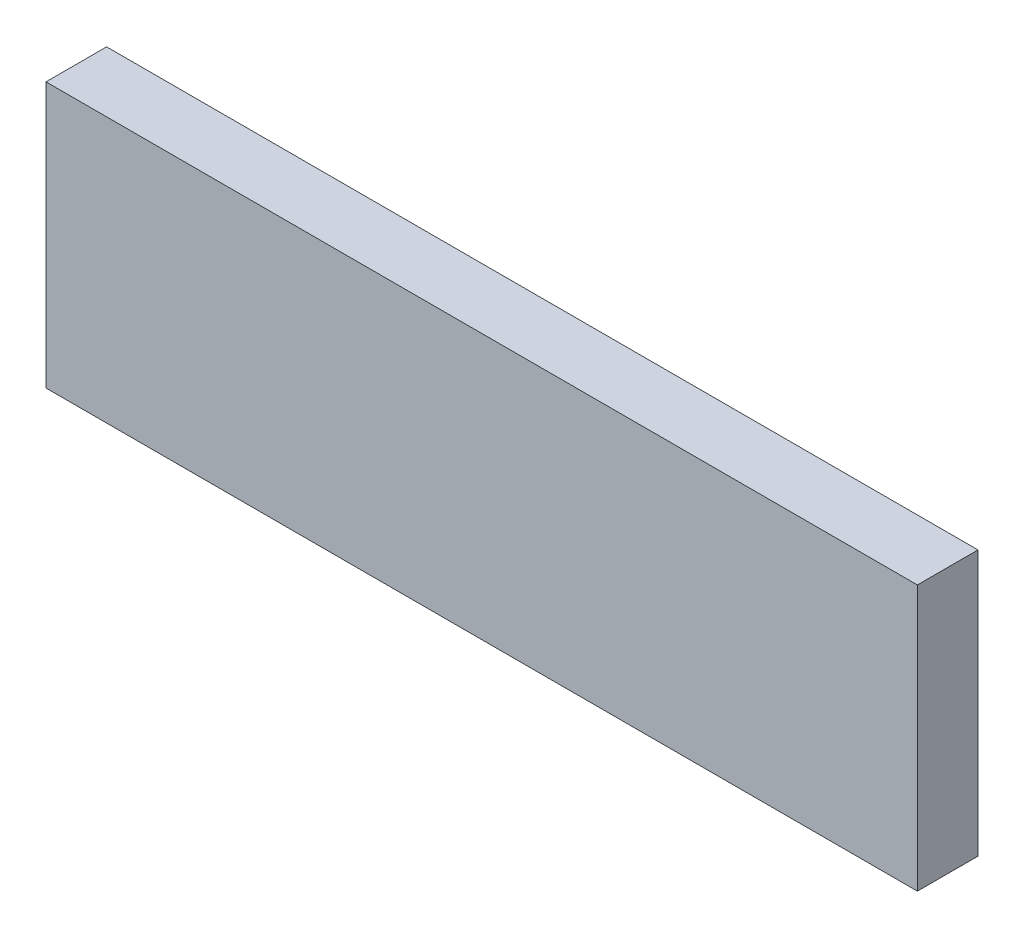
from build123d import *

# Parameters (mm, degrees)
SKETCH_1_W        = 230
SKETCH_1_H        = 70
EXTRUDE_308_DEPTH = 16


with BuildPart() as part:
    # 草图1 → Extrude 308 (new body)
    with BuildSketch(Plane.XY):
        Rectangle(SKETCH_1_W, SKETCH_1_H)
    extrude(amount=EXTRUDE_308_DEPTH)


solid = part.part
